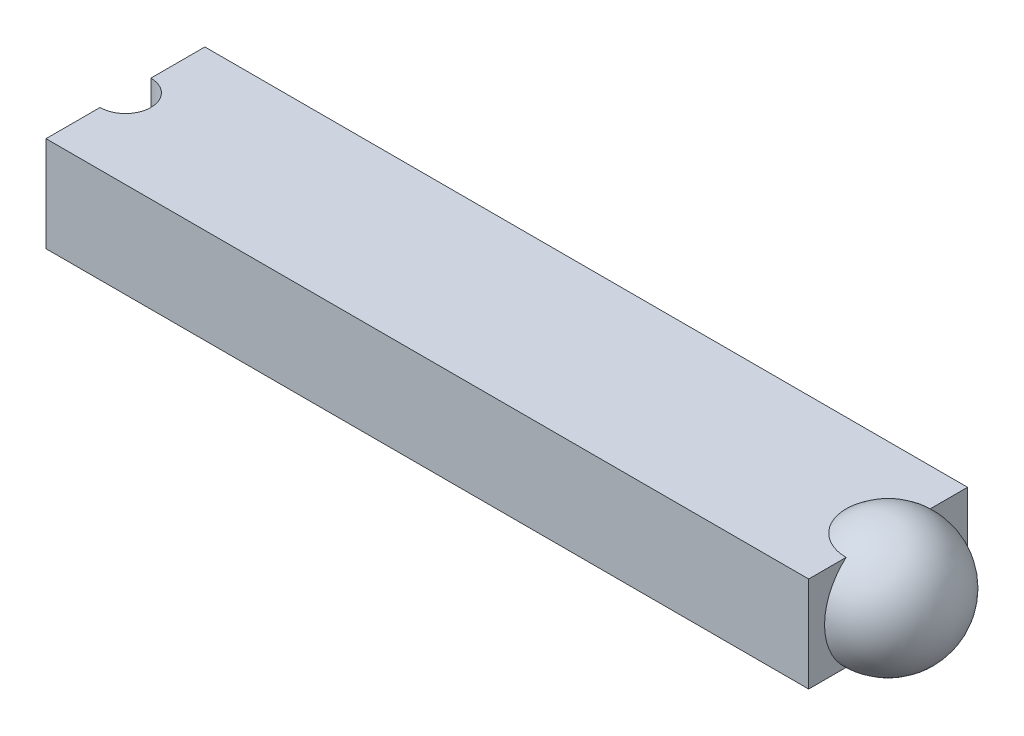
from build123d import *

# Parameters (mm, degrees)
SKETCH2_W           = 25
SKETCH2_H           = 15
BOSS_EXTRUDE1_DEPTH = 120
SKETCH3_R           = 4
CUT_EXTRUDE1_DEPTH  = 25


with BuildPart() as part:
    # Sketch2 → Boss-Extrude1 (new body)
    with BuildSketch(Plane(origin=(0, 0, 0), x_dir=(0, 0, -1), z_dir=(1, 0, 0))):
        Rectangle(SKETCH2_W, SKETCH2_H)
    extrude(amount=BOSS_EXTRUDE1_DEPTH)

    # Sketch3 → Cut-Extrude1 (cut)
    with BuildSketch(Plane(origin=(0, -12.5, 0), x_dir=(1, 0, 0), z_dir=(0, 1, 0))):
        Circle(SKETCH3_R)
    extrude(amount=CUT_EXTRUDE1_DEPTH, mode=Mode.SUBTRACT)

    # Sketch4 → Revolve1 (revolve)
    with BuildSketch(Plane.XY):
        with BuildLine():
            Line((120, -10), (120, 10))
            ThreePointArc((120, 10), (130, 0), (120, -10))
        make_face()
    revolve(axis=Axis((120, -10, 0), (0, 1, 0)))


solid = part.part
